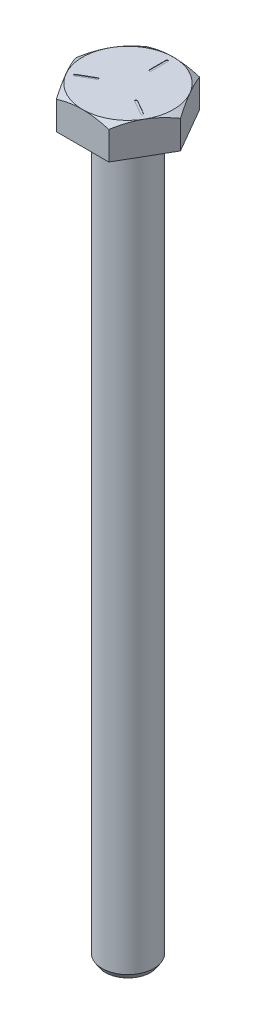
from build123d import *

# Parameters (mm, degrees)
BOSS_EXTRUDE1_DEPTH = 3.9624
CUT_EXTRUDE1_DEPTH  = 0.0508


with BuildPart() as part:
    # Sketch1 → Boss-Extrude1 (new body)
    with BuildSketch(Plane(origin=(0, 0, 0), x_dir=(1, 0, 0), z_dir=(0, 1, 0))):
        Polygon((6.415804866, 0), (3.207902433, 5.55625), (-3.207902433, 5.55625), (-6.415804866, 0), (-3.207902433, -5.55625), (3.207902433, -5.55625), align=None)
    extrude(amount=BOSS_EXTRUDE1_DEPTH)

    # Sketch2 → Cut-Revolve1 (revolve, cut)
    with BuildSketch(Plane.XY):
        Polygon((5.55625, 3.9624), (6.415804866, 3.4544), (6.415804866, 3.9624), align=None)
    revolve(axis=Axis((0, 0, 0), (0, 1, 0)), mode=Mode.SUBTRACT)

    # Sketch3 → Cut-Extrude1 (cut)
    with BuildSketch(Plane(origin=(0, 3.9624, 0), x_dir=(-1, 0, 0), z_dir=(0, -1, 0))):
        with BuildLine():
            Line((0.127, 4.7625), (0.127, 2.7305))
            ThreePointArc((0.127, 2.7305), (0, 2.6035), (-0.127, 2.7305))
            Line((-0.127, 2.7305), (-0.127, 4.7625))
            ThreePointArc((-0.127, 4.7625), (0, 4.8895), (0.127, 4.7625))
        make_face()
        with BuildLine():
            Line((4.060945986, -2.491235226), (2.301182365, -1.475235226))
            ThreePointArc((2.301182365, -1.475235226), (2.254697139, -1.30175), (2.428182365, -1.255264774))
            Line((2.428182365, -1.255264774), (4.187945986, -2.271264774))
            ThreePointArc((4.187945986, -2.271264774), (4.234431212, -2.44475), (4.060945986, -2.491235226))
        make_face()
        with BuildLine():
            Line((-4.187945986, -2.271264774), (-2.428182365, -1.255264774))
            ThreePointArc((-2.428182365, -1.255264774), (-2.254697139, -1.30175), (-2.301182365, -1.475235226))
            Line((-2.301182365, -1.475235226), (-4.060945986, -2.491235226))
            ThreePointArc((-4.060945986, -2.491235226), (-4.234431212, -2.44475), (-4.187945986, -2.271264774))
        make_face()
    extrude(amount=CUT_EXTRUDE1_DEPTH, mode=Mode.SUBTRACT)

    # Bolt Length Sketch → Bolt Length (revolve)
    with BuildSketch(Plane.XY, mode=Mode.PRIVATE) as bolt_length_sk:
        Polygon((0, 0), (0, -88.9), (2.778125, -88.9), (3.175, -88.265), (3.175, 0), align=None)
    revolve(bolt_length_sk.sketch.rotate(Axis((0, 0, 0), (0, -1, 0)), 180), axis=Axis((0, 0, 0), (0, -1, 0)))


solid = part.part
